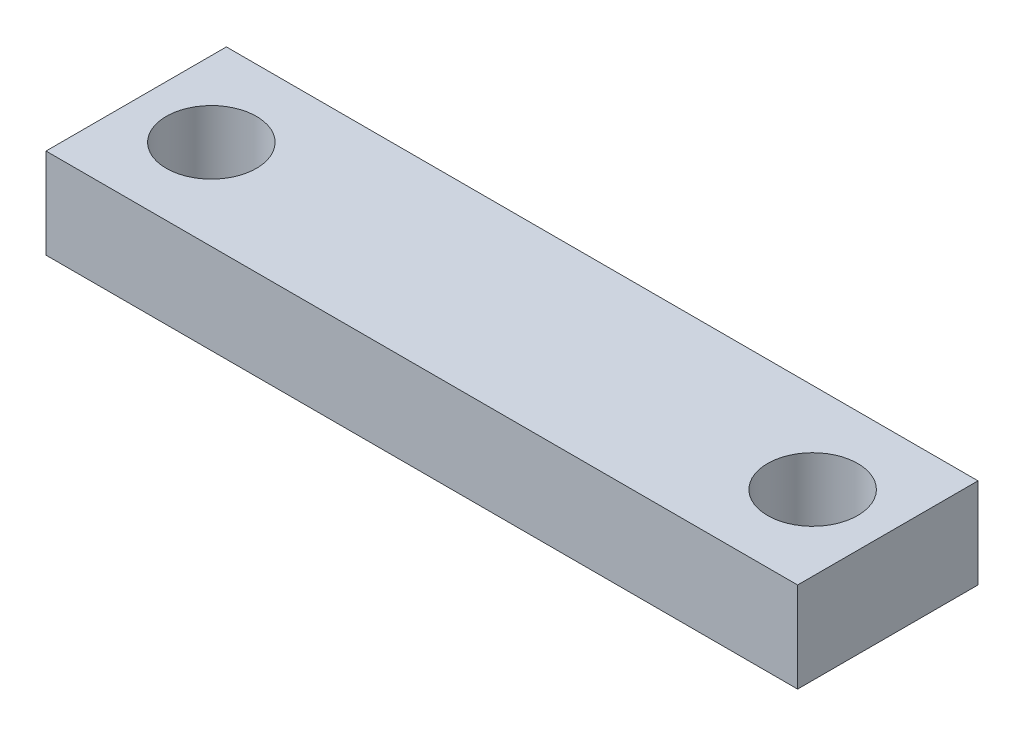
from build123d import *

# Parameters (mm, degrees)
SKETCH1_W           = 25
SKETCH1_H           = 6
BOSS_EXTRUDE1_DEPTH = 3
SKETCH2_R           = 1.5
CUT_EXTRUDE1_DEPTH  = 3


with BuildPart() as part:
    # Sketch1 → Boss-Extrude1 (new body)
    with BuildSketch(Plane(origin=(0, 0, 0), x_dir=(1, 0, 0), z_dir=(0, 1, 0))):
        with Locations((12.5, -3)):
            Rectangle(SKETCH1_W, SKETCH1_H)
    extrude(amount=BOSS_EXTRUDE1_DEPTH)

    # Sketch2 → Cut-Extrude1 (cut)
    with BuildSketch(Plane(origin=(0, 3, 0), x_dir=(1, 0, 0), z_dir=(0, 1, 0))):
        with Locations(Location((2.5, -3, 0), (0, 0, 270))):
            Circle(SKETCH2_R)
        with Locations(Location((22.5, -3, 0), (0, 0, 270))):
            Circle(SKETCH2_R)
    extrude(amount=-CUT_EXTRUDE1_DEPTH, mode=Mode.SUBTRACT)


solid = part.part
